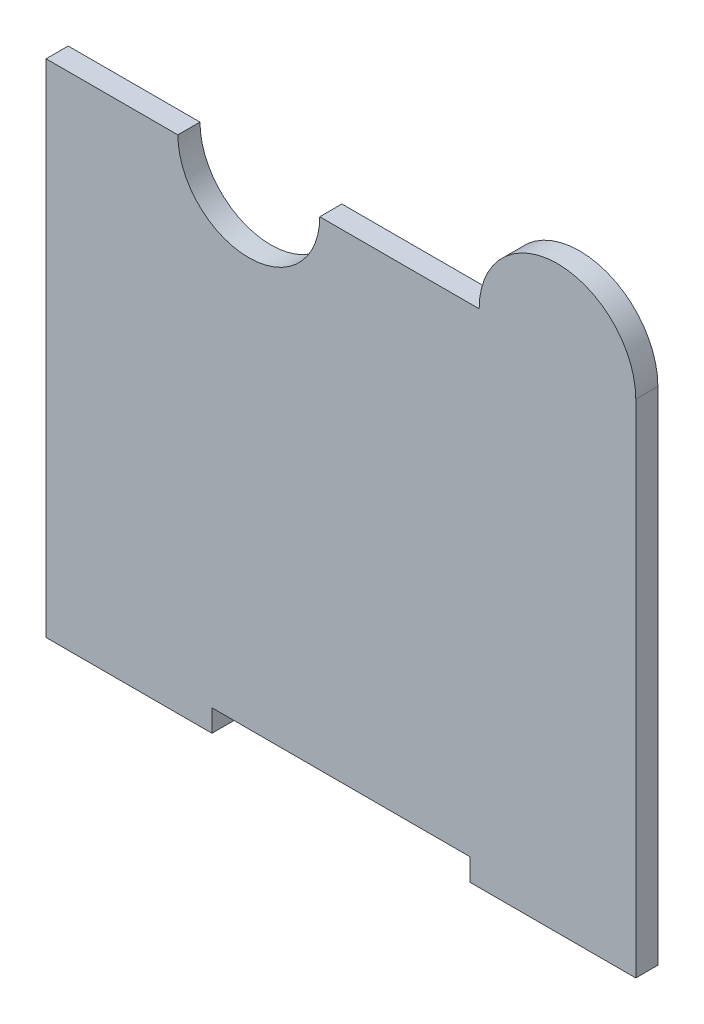
from build123d import *

# Parameters (mm, degrees)
BOSS_EXTRUDE1_DEPTH = 6


with BuildPart() as part:
    # Sketch1 → Boss-Extrude1 (new body)
    with BuildSketch(Plane.XY):
        with BuildLine():
            Line((-55, 0), (-19.25, 0))
            ThreePointArc((-19.25, 0), (0, -19.25), (19.25, 0))
            Line((19.25, 0), (62.5, 0))
            ThreePointArc((62.5, 0), (83.75, 21.25), (105, 0))
            Line((105, 0), (105, -136))
            Line((105, -136), (60, -136))
            Line((60, -136), (60, -130))
            Line((60, -130), (-10, -130))
            Line((-10, -130), (-10, -136))
            Line((-10, -136), (-55, -136))
            Line((-55, -136), (-55, 0))
        make_face()
    extrude(amount=BOSS_EXTRUDE1_DEPTH)


solid = part.part
